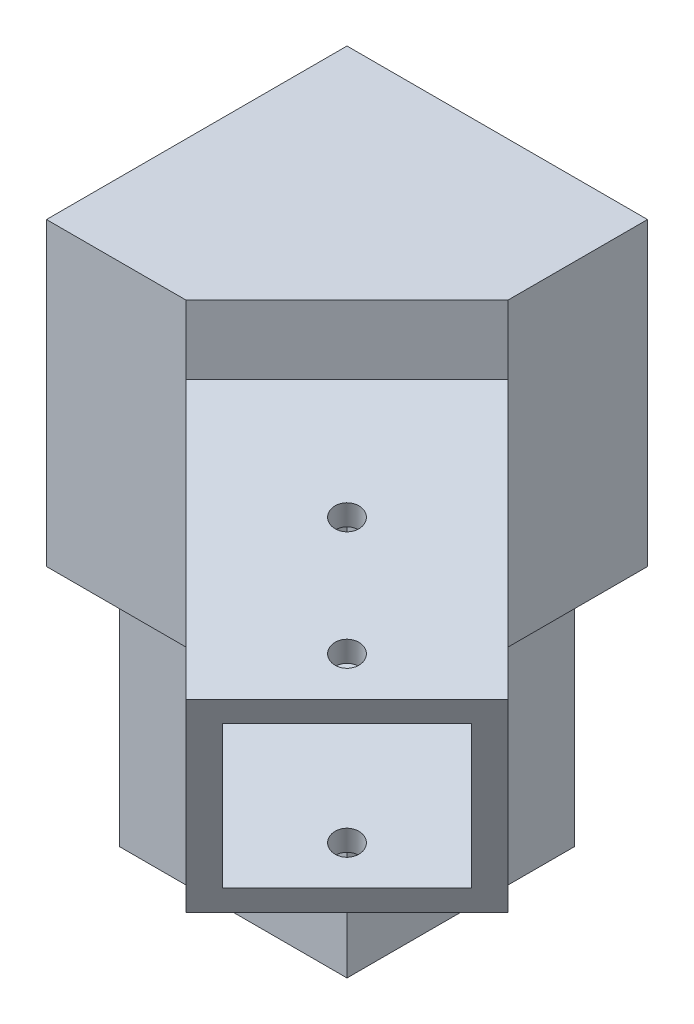
from build123d import *

# Parameters (mm, degrees)
SKETCH_4_W          = 26.5
SKETCH_4_H          = 26.5
SKETCH_4_W_2        = 20.5
SKETCH_4_H_2        = 20.5
EXTRUDE_1_DEPTH     = 50
EXTRUDE_2_DEPTH     = 50
EXTRUDE_3_DEPTH     = 17.5
SKETCH_4_2_W        = 20.5
SKETCH_4_2_H        = 20.5
CUT_EXTRUDE_1_DEPTH = 82.971372719
CUT_EXTRUDE_2_DEPTH = 82.971372719
CUT_EXTRUDE_3_REACH = 90.259
SKETCH_7_R          = 1.6
SKETCH_9_R          = 1.6
CUT_EXTRUDE_4_DEPTH = 76.350501248


with BuildPart() as part:
    # 草图4 → 凸台-拉伸1 (new body)
    with BuildSketch(Plane(origin=(0, 0, 0), x_dir=(1, 0, 0), z_dir=(0, 1, 0))):
        Rectangle(SKETCH_4_W, SKETCH_4_H)
        Rectangle(SKETCH_4_W_2, SKETCH_4_H_2, mode=Mode.SUBTRACT)
    extrude(amount=-EXTRUDE_1_DEPTH)

    # 草图5 → 凸台-拉伸2 (add)
    with BuildSketch(Plane(origin=(0, 0, 0), x_dir=(0.7254762501100117, 0.21764287503300356, -0.6529286250990104), z_dir=(0.6882472016116853, -0.22941573387056186, 0.6882472016116854))):
        Polygon((-9.951712437, 15.877292577), (15.877292577, 9.951712437), (9.951712437, -15.877292577), (-15.877292577, -9.951712437), align=None)
        Polygon((-7.698494526, 12.28243388), (12.28243388, 7.698494526), (7.698494526, -12.28243388), (-12.28243388, -7.698494526), align=None, mode=Mode.SUBTRACT)
    extrude(amount=EXTRUDE_2_DEPTH)

    # 草图6 → 凸台-拉伸3 (add, symmetric)
    with BuildSketch(Plane(origin=(0, 0, 0), x_dir=(1, 0, 0), z_dir=(0, 1, 0))):
        Polygon((-13.25, 13.25), (-13.25, -21.75), (3.011670299, -21.75), (21.75, -3.011670299), (21.75, 13.25), align=None)
    extrude(amount=EXTRUDE_3_DEPTH, both=True)

    # 草图4<2> → 切除-拉伸1 (cut, through all)
    with BuildSketch(Plane(origin=(0, 0, 0), x_dir=(1, 0, 0), z_dir=(0, 1, 0))):
        Rectangle(SKETCH_4_2_W, SKETCH_4_2_H)
    extrude(amount=-CUT_EXTRUDE_1_DEPTH, mode=Mode.SUBTRACT)

    # 草图5<2> → 切除-拉伸2 (cut, through all)
    with BuildSketch(Plane(origin=(0, 0, 0), x_dir=(0.7254762501100117, 0.21764287503300356, -0.6529286250990104), z_dir=(0.6882472016116853, -0.22941573387056186, 0.6882472016116854))):
        Polygon((12.28243388, 7.698494526), (7.698494526, -12.28243388), (-12.28243388, -7.698494526), (-7.698494526, 12.28243388), align=None)
    extrude(amount=CUT_EXTRUDE_2_DEPTH, mode=Mode.SUBTRACT)

    # 切除-拉伸3: up to this face of the body (flat: up to its plane)
    cut_extrude_3_end = Plane(part.part.faces().sort_by_distance((22.026190668, -20.955144479, 22.026190668))[0])
    # 草图7 → 切除-拉伸3 (cut, up to the picked face)
    with BuildSketch(Plane(origin=(2.14943383, 12.89660298, 2.14943383), x_dir=(0.9867543820659302, -0.16001422411879954, -0.02666903735313327), z_dir=(0.16222142113076257, 0.9733285267845753, 0.16222142113076257)), mode=Mode.PRIVATE) as cut_extrude_3_sk1:
        with Locations(Location((31.386862461, -32.246935744, 0), (0, 0, 270))):
            Circle(SKETCH_7_R)
    cut_extrude_3_tool1 = split(extrude(cut_extrude_3_sk1.sketch, amount=-CUT_EXTRUDE_3_REACH, mode=Mode.PRIVATE), bisect_by=cut_extrude_3_end, keep=Keep.BOTH, mode=Mode.PRIVATE)
    # 草图7 → 切除-拉伸3 (cut, up to the picked face)
    with BuildSketch(Plane(origin=(2.14943383, 12.89660298, 2.14943383), x_dir=(0.9867543820659302, -0.16001422411879954, -0.02666903735313327), z_dir=(0.16222142113076257, 0.9733285267845753, 0.16222142113076257)), mode=Mode.PRIVATE) as cut_extrude_3_sk2:
        with Locations(Location((20.924574974, -21.497957163, 0), (0, 0, 270))):
            Circle(SKETCH_7_R)
    cut_extrude_3_tool2 = split(extrude(cut_extrude_3_sk2.sketch, amount=-CUT_EXTRUDE_3_REACH, mode=Mode.PRIVATE), bisect_by=cut_extrude_3_end, keep=Keep.BOTH, mode=Mode.PRIVATE)
    add(cut_extrude_3_tool1.solids().sort_by(Axis((33.120558, 2.572895, 33.120558), (-0.16222142113076257, -0.9733285267845753, -0.16222142113076257)))[0], mode=Mode.SUBTRACT)
    add(cut_extrude_3_tool2.solids().sort_by(Axis((22.79685, 6.014131, 22.79685), (-0.16222142113076257, -0.9733285267845753, -0.16222142113076257)))[0], mode=Mode.SUBTRACT)

    # 草图9 → 切除-拉伸4 (cut, through all)
    with BuildSketch(Plane(origin=(13.25, 0, 0), x_dir=(0, 0, -1), z_dir=(1, 0, 0))):
        with Locations((0, -42.5)):
            Circle(SKETCH_9_R)
        with Locations((0, -22.5)):
            Circle(SKETCH_9_R)
    extrude(amount=-CUT_EXTRUDE_4_DEPTH, mode=Mode.SUBTRACT)


solid = part.part
